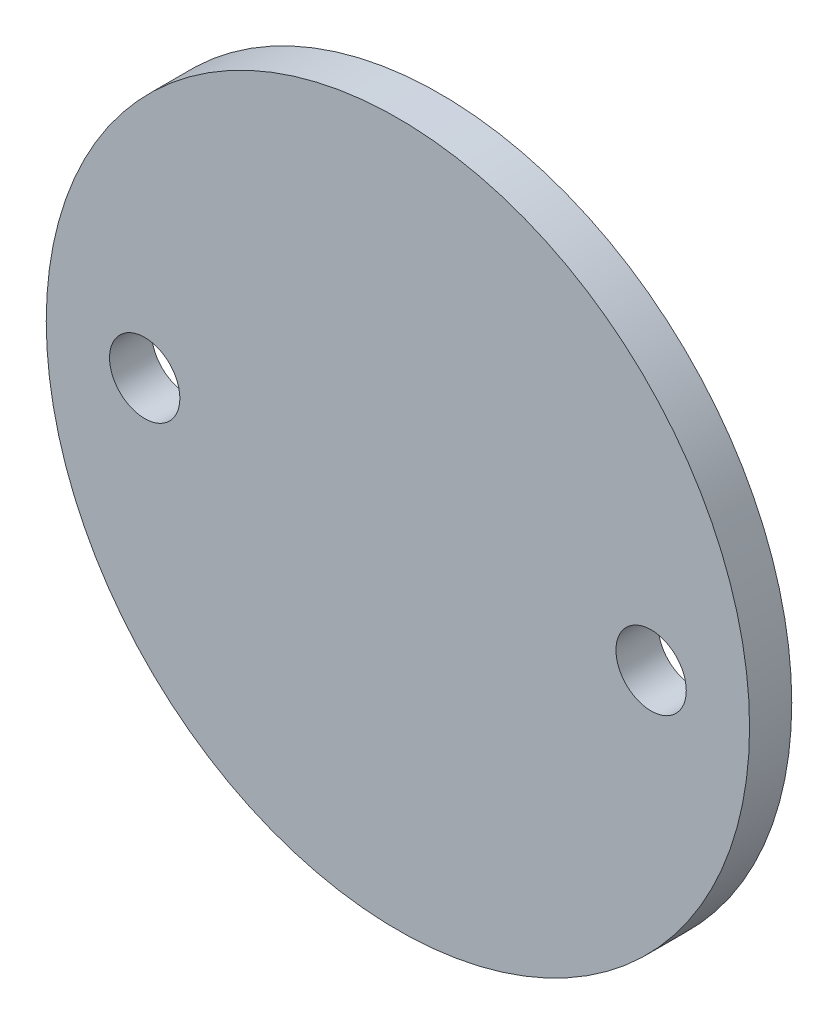
from build123d import *

# Parameters (mm, degrees)
SKETCH1_R           = 25
SKETCH1_R_2         = 2.5
BOSS_EXTRUDE1_DEPTH = 3


with BuildPart() as part:
    # Sketch1 → Boss-Extrude1 (new body)
    with BuildSketch(Plane.XY):
        Circle(SKETCH1_R)
        with Locations((-18, 0)):
            Circle(SKETCH1_R_2, mode=Mode.SUBTRACT)
        with Locations((18, 0)):
            Circle(SKETCH1_R_2, mode=Mode.SUBTRACT)
    extrude(amount=BOSS_EXTRUDE1_DEPTH)


solid = part.part
